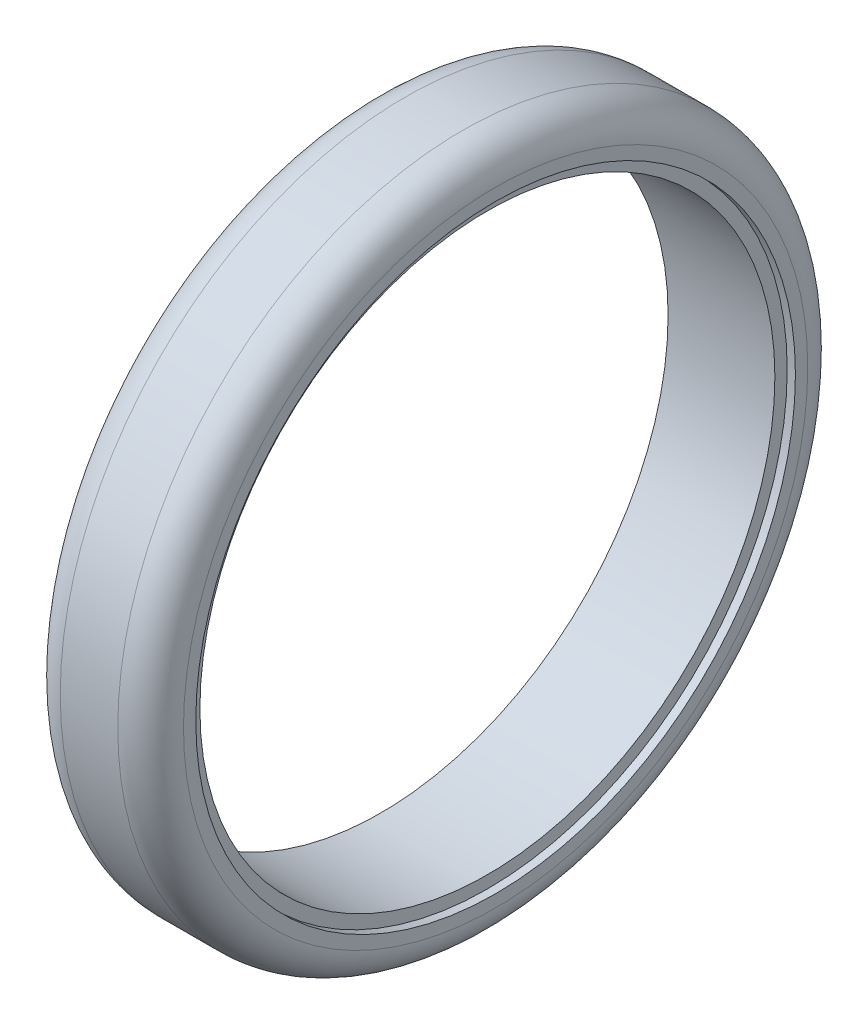
from build123d import *


with BuildPart() as part:
    # Sketch1 → Revolve1 (revolve)
    with BuildSketch(Plane.XY, mode=Mode.PRIVATE) as revolve1_sk:
        with BuildLine():
            Line((-3.5, 42), (3.5, 42))
            ThreePointArc((3.5, 42), (6.328427125, 40.828427125), (7.5, 38))
            Line((7.5, 38), (7.5, 36.5))
            Line((7.5, 36.5), (6.5, 36.5))
            Line((6.5, 36.5), (6.5, 35))
            Line((6.5, 35), (-6.5, 35))
            Line((-6.5, 35), (-6.5, 36.5))
            Line((-6.5, 36.5), (-7.5, 36.5))
            Line((-7.5, 36.5), (-7.5, 38))
            ThreePointArc((-7.5, 38), (-6.328427125, 40.828427125), (-3.5, 42))
        make_face()
        Polygon((-2.542209765, 42), (-3.292209765, 42), (-3.292209765, 41), (-1.792209765, 41), (-1.792209765, 42), align=None)
        Polygon((3.207790235, 41), (3.207790235, 42), (2.457790235, 42), (1.707790235, 42), (1.707790235, 41), align=None)
    revolve(revolve1_sk.sketch.rotate(Axis((-13.410818461, 0, 0), (1, 0, 0)), 90), axis=Axis((-13.410818461, 0, 0), (1, 0, 0)))


solid = part.part
